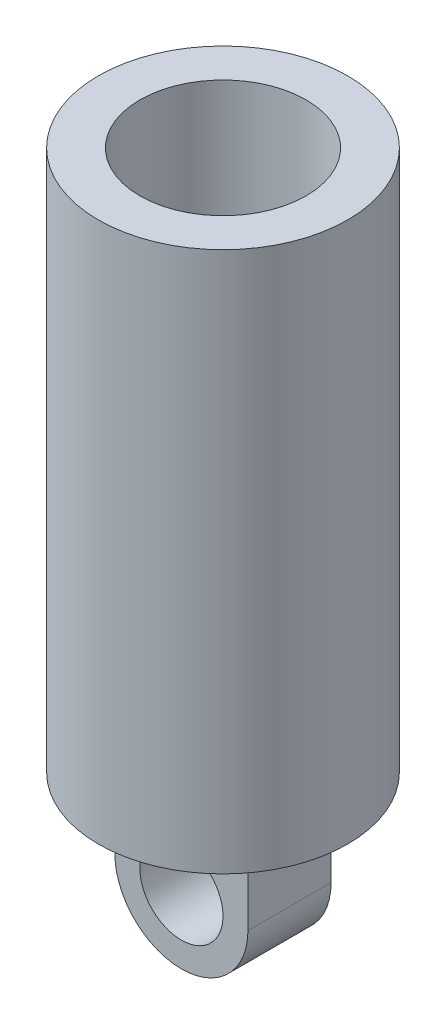
from build123d import *

# Parameters (mm, degrees)
SKETCH1_R           = 2.5
BOSS_EXTRUDE1_DEPTH = 2.5
SKETCH2_R           = 7.5
BOSS_EXTRUDE2_DEPTH = 2.5
SKETCH3_R           = 7.5
SKETCH3_R_2         = 5
BOSS_EXTRUDE4_DEPTH = 30


with BuildPart() as part:
    # Sketch1 → Boss-Extrude1 (new, symmetric)
    with BuildSketch(Plane.XY):
        with BuildLine():
            Line((-4, 0), (-4, 5))
            Line((-4, 5), (4, 5))
            Line((4, 5), (4, 0))
            ThreePointArc((4, 0), (0, -4), (-4, 0))
        make_face()
        Circle(SKETCH1_R, mode=Mode.SUBTRACT)
    extrude(amount=BOSS_EXTRUDE1_DEPTH, both=True)

    # Sketch2 → Boss-Extrude2 (add)
    with BuildSketch(Plane(origin=(0, 5, 0), x_dir=(1, 0, 0), z_dir=(0, 1, 0))):
        with Locations(Location((0, 0, 0), (0, 0, 270))):
            Circle(SKETCH2_R)
    extrude(amount=BOSS_EXTRUDE2_DEPTH)

    # Sketch3 → Boss-Extrude4 (add)
    with BuildSketch(Plane(origin=(0, 7.5, 0), x_dir=(1, 0, 0), z_dir=(0, 1, 0))):
        with Locations(Location((0, 0, 0), (0, 0, 270))):
            Circle(SKETCH3_R)
        with Locations(Location((0, 0, 0), (0, 0, 270))):
            Circle(SKETCH3_R_2, mode=Mode.SUBTRACT)
    extrude(amount=BOSS_EXTRUDE4_DEPTH)


solid = part.part
